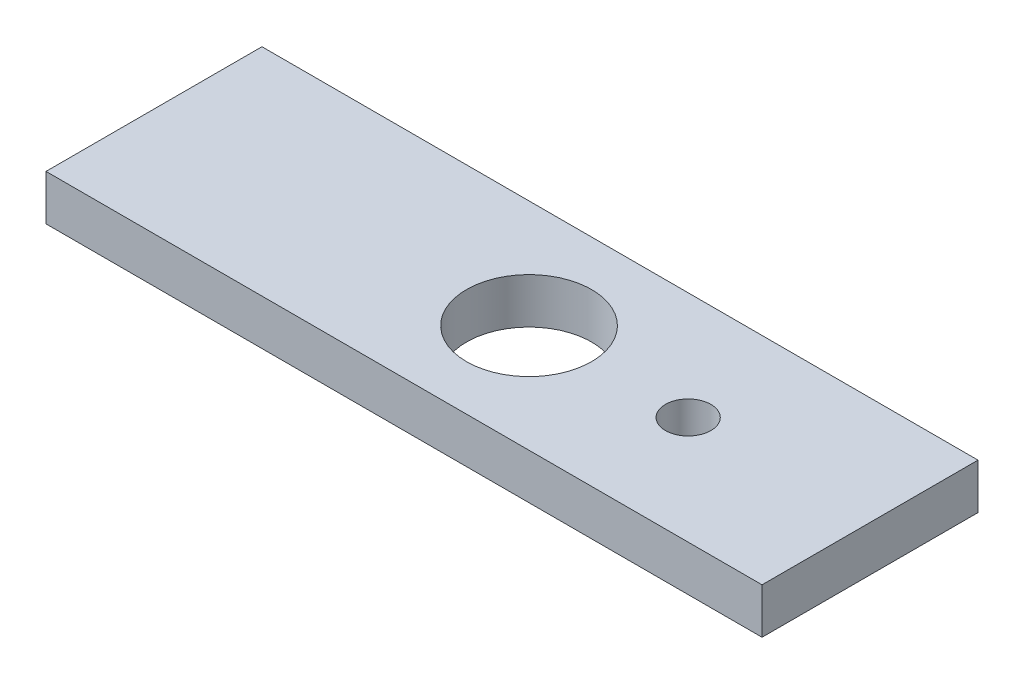
from build123d import *

# Parameters (mm, degrees)
SKETCH1_W           = 63
SKETCH1_H           = 19
BOSS_EXTRUDE1_DEPTH = 4
SKETCH2_R           = 5.5
SKETCH2_R_2         = 2
CUT_EXTRUDE1_DEPTH  = 34.143626838


with BuildPart() as part:
    # Sketch1 → Boss-Extrude1 (new body)
    with BuildSketch(Plane(origin=(0, 0, 0), x_dir=(1, 0, 0), z_dir=(0, 1, 0))):
        Rectangle(SKETCH1_W, SKETCH1_H)
    extrude(amount=BOSS_EXTRUDE1_DEPTH)

    # Sketch2 → Cut-Extrude1 (cut, through all)
    with BuildSketch(Plane(origin=(0, 4, 0), x_dir=(1, 0, 0), z_dir=(0, 1, 0))):
        with Locations(Location((1.5, 0, 0), (0, 0, 270))):
            Circle(SKETCH2_R)
        with Locations(Location((15.5, 0, 0), (0, 0, 270))):
            Circle(SKETCH2_R_2)
    extrude(amount=-CUT_EXTRUDE1_DEPTH, mode=Mode.SUBTRACT)


solid = part.part
